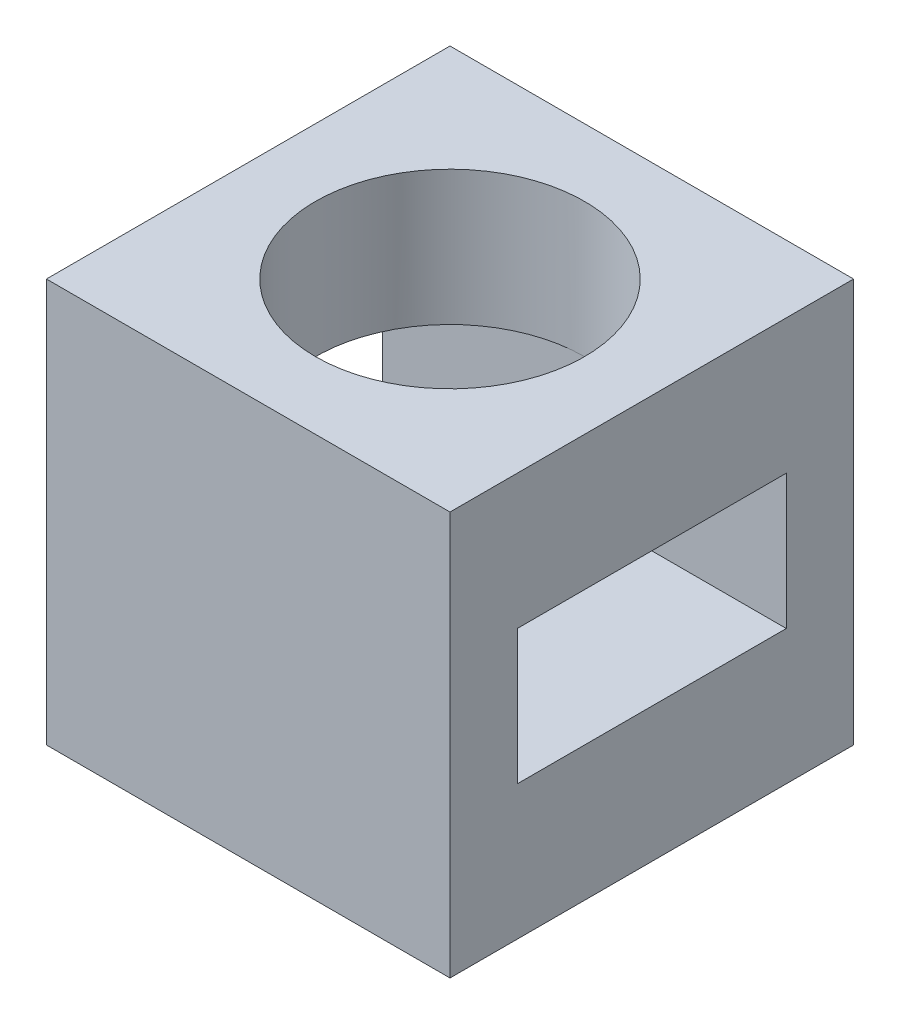
from build123d import *

# Parameters (mm, degrees)
SKETCH1_W           = 150
SKETCH1_H           = 150
SKETCH1_W_2         = 100
SKETCH1_H_2         = 50
BOSS_EXTRUDE1_DEPTH = 150
SKETCH3_R           = 50
CUT_EXTRUDE1_DEPTH  = 50


with BuildPart() as part:
    # Sketch1 → Boss-Extrude1 (new body)
    with BuildSketch(Plane(origin=(0, 0, 0), x_dir=(0, 0, -1), z_dir=(1, 0, 0))):
        Rectangle(SKETCH1_W, SKETCH1_H)
        Rectangle(SKETCH1_W_2, SKETCH1_H_2, mode=Mode.SUBTRACT)
    extrude(amount=BOSS_EXTRUDE1_DEPTH)

    # Sketch3 → Cut-Extrude1 (cut)
    with BuildSketch(Plane(origin=(0, 75, 0), x_dir=(1, 0, 0), z_dir=(0, 1, 0))):
        with Locations(Location((75, 0, 0), (0, 0, 270))):
            Circle(SKETCH3_R)
    extrude(amount=-CUT_EXTRUDE1_DEPTH, mode=Mode.SUBTRACT)


solid = part.part
